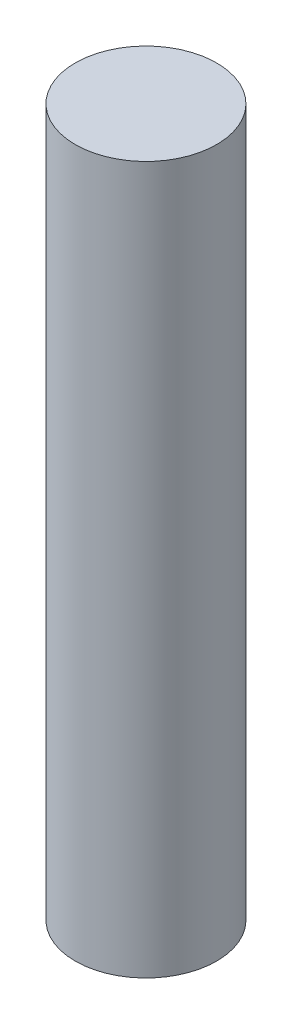
from build123d import *

# Parameters (mm, degrees)
SKETCH1_R           = 2.54
BOSS_EXTRUDE1_DEPTH = 25.4


with BuildPart() as part:
    # Sketch1 → Boss-Extrude1 (new body)
    with BuildSketch(Plane(origin=(0, 0, 0), x_dir=(1, 0, 0), z_dir=(0, 1, 0))):
        with Locations(Location((0, 0, 0), (0, 0, 270))):
            Circle(SKETCH1_R)
    extrude(amount=BOSS_EXTRUDE1_DEPTH)


solid = part.part
